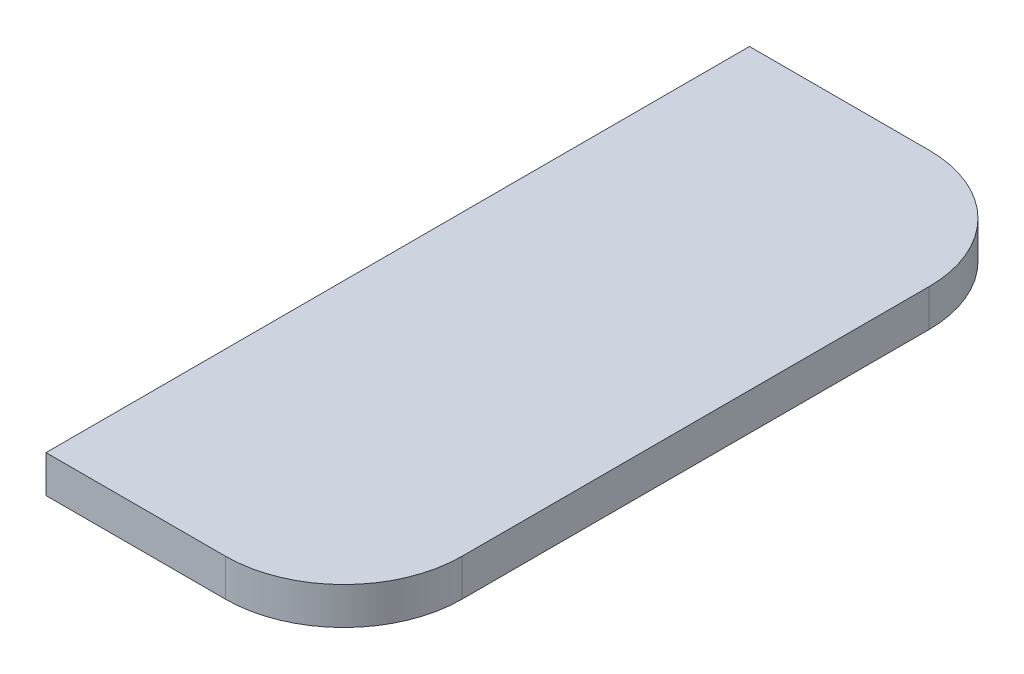
from build123d import *

# Parameters (mm, degrees)
SKETCH1_W           = 8
SKETCH1_H           = 18.9
BOSS_EXTRUDE1_DEPTH = 1
FILLET1_R           = 3.175


with BuildPart() as part:
    # Sketch1 → Boss-Extrude1 (new body)
    with BuildSketch(Plane(origin=(0, 0, 0), x_dir=(1, 0, 0), z_dir=(0, 1, 0))):
        Rectangle(SKETCH1_W, SKETCH1_H)
    extrude(amount=BOSS_EXTRUDE1_DEPTH)

    # Fillet1
    fillet1_edges = [part.edges().sort_by_distance(p)[0] for p in [
        (4, 0.5, -9.45),
        (4, 0.5, 9.45),
    ]]
    fillet(fillet1_edges, radius=FILLET1_R)


solid = part.part
